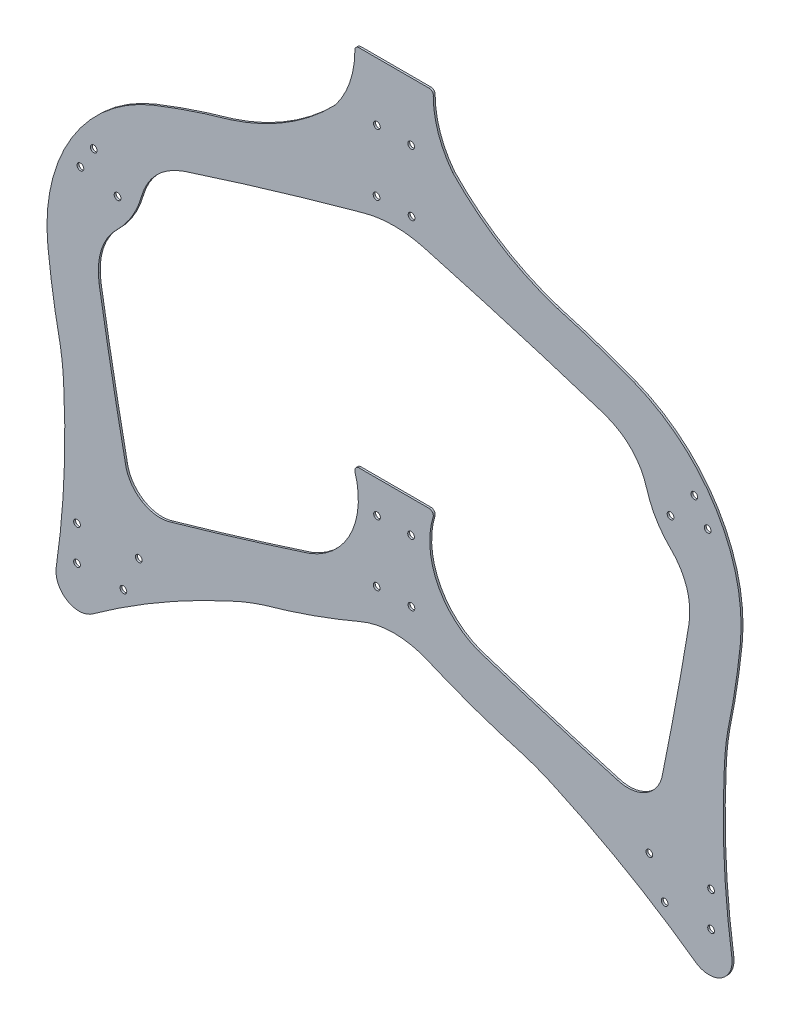
from build123d import *

# Parameters (mm, degrees)
MODEL_R             = 11.1125
BOSS_EXTRUDE1_DEPTH = 6.35


with BuildPart() as part:
    # Model → Boss-Extrude1 (new body)
    with BuildSketch(Plane.XY):
        with BuildLine():
            Line((0, 1378.747657242), (-115.577769156, 1378.747657242))
            ThreePointArc((-115.577769156, 1378.747657242), (-126.354237016, 1373.686301835), (-129.340509975, 1362.161036029))
            ThreePointArc((-129.340509975, 1362.161036029), (-146.260418002, 1263.666616997), (-193.874021232, 1175.800931685))
            ThreePointArc((-193.874021232, 1175.800931685), (-220.418203668, 1149.393572736), (-248.132597313, 1124.217103311))
            ThreePointArc((-248.132597313, 1124.217103311), (-385.537532949, 1027.598742212), (-539.656545931, 960.796392886))
            ThreePointArc((-539.656545931, 960.796392886), (-666.621490092, 921.783047123), (-791.407826106, 876.280206141))
            ThreePointArc((-791.407826106, 876.280206141), (-1063.983941582, 646.703245394), (-1142.358434641, 299.052906014))
            ThreePointArc((-1142.358434641, 299.052906014), (-1125.326882546, 167.325671067), (-1101.531285955, 36.65085415))
            ThreePointArc((-1101.531285955, 36.65085415), (-1096.501853159, 3.57345863), (-1092.816970275, -29.680577618))
            ThreePointArc((-1092.816970275, -29.680577618), (-1090.951890328, -54.49551316), (-1089.83566214, -79.355392158))
            ThreePointArc((-1089.83566214, -79.355392158), (-1089.396534052, -343.386369753), (-1114.815066971, -606.191331934))
            ThreePointArc((-1114.815066971, -606.191331934), (-1079.006418537, -682.346700796), (-994.915452979, -679.089551631))
            ThreePointArc((-994.915452979, -679.089551631), (-773.294078723, -535.574709695), (-538.684025262, -414.452184132))
            ThreePointArc((-538.684025262, -414.452184133), (-516.099583467, -404.002152581), (-493.210405664, -394.237639785))
            ThreePointArc((-493.210405664, -394.237639785), (-461.991455066, -382.204917214), (-430.310537922, -371.447186142))
            ThreePointArc((-430.310537922, -371.447186142), (-268.597105794, -320.492031035), (-110.58408698, -259.014003675))
            ThreePointArc((-110.58408698, -259.014003675), (-56.439186179, -242.1159729), (0, -236.473988301))
            ThreePointArc((0, -236.473988301), (56.43918618, -242.1159729), (110.58408698, -259.014003675))
            ThreePointArc((110.58408698, -259.014003675), (268.597105792, -320.492031034), (430.310537918, -371.447186141))
            ThreePointArc((430.310537918, -371.447186141), (461.991455064, -382.204917213), (493.210405664, -394.237639786))
            ThreePointArc((493.210405664, -394.237639786), (516.099583466, -404.00215258), (538.68402526, -414.452184132))
            ThreePointArc((538.68402526, -414.452184132), (773.294078724, -535.574709696), (994.915452984, -679.089551635))
            ThreePointArc((994.915452984, -679.089551635), (1079.00641854, -682.346700795), (1114.815066971, -606.191331934))
            ThreePointArc((1114.815066971, -606.191331934), (1089.396534052, -343.386369752), (1089.83566214, -79.355392158))
            ThreePointArc((1089.83566214, -79.355392158), (1090.951890328, -54.49551316), (1092.816970275, -29.680577618))
            ThreePointArc((1092.816970275, -29.680577618), (1096.501853159, 3.57345863), (1101.531285955, 36.65085415))
            ThreePointArc((1101.531285955, 36.65085415), (1125.326882546, 167.325671068), (1142.358434641, 299.052906016))
            ThreePointArc((1142.358434641, 299.052906016), (1063.983941581, 646.703245395), (791.407826106, 876.280206141))
            ThreePointArc((791.407826106, 876.280206141), (666.621490092, 921.783047123), (539.656545931, 960.796392886))
            ThreePointArc((539.656545931, 960.796392886), (385.537532949, 1027.598742212), (248.132597313, 1124.217103311))
            ThreePointArc((248.132597313, 1124.217103311), (220.418203668, 1149.393572736), (193.874021232, 1175.800931685))
            ThreePointArc((193.874021232, 1175.800931685), (146.260418002, 1263.666616998), (129.340509975, 1362.161036029))
            ThreePointArc((129.340509975, 1362.161036029), (126.354237016, 1373.686301835), (115.577769156, 1378.747657242))
            Line((115.577769156, 1378.747657242), (0, 1378.747657242))
        make_face()
        with Locations((-1046.167083964, -560.153855558)):
            Circle(MODEL_R, mode=Mode.SUBTRACT)
        with Locations((-1046.167083964, -445.853855558)):
            Circle(MODEL_R, mode=Mode.SUBTRACT)
        with Locations((-893.117492798, -558.918230591)):
            Circle(MODEL_R, mode=Mode.SUBTRACT)
        with Locations((-842.317492798, -444.618230591)):
            Circle(MODEL_R, mode=Mode.SUBTRACT)
        with Locations((-57.451404862, -132.047353673)):
            Circle(MODEL_R, mode=Mode.SUBTRACT)
        with Locations((-56.215779894, 71.187101166)):
            Circle(MODEL_R, mode=Mode.SUBTRACT)
        with BuildLine():
            Line((-831.914958661, -276.08435652), (-832.041240206, -276.007578126))
            ThreePointArc((-832.041240206, -276.007578126), (-868.388484856, -241.139134025), (-886.576073785, -194.169546028))
            ThreePointArc((-886.576073785, -194.169546028), (-931.96319087, 39.874447812), (-973.090543462, 274.704433799))
            ThreePointArc((-973.090543462, 274.704433799), (-974.544978645, 289.261052289), (-975.513775637, 303.85803677))
            ThreePointArc((-975.513775637, 303.85803677), (-961.568129404, 388.552365855), (-913.897564598, 459.932528919))
            ThreePointArc((-913.897564598, 459.932528919), (-864.708312264, 522.01822335), (-833.367311336, 594.764066249))
            ThreePointArc((-833.367311336, 594.764066249), (-793.126920462, 670.574883137), (-725.17703841, 723.009438004))
            ThreePointArc((-725.17703841, 723.009438004), (-708.680158975, 730.452237286), (-691.890632454, 737.209018431))
            ThreePointArc((-691.890632454, 737.209018431), (-396.292230767, 829.345390272), (-98.602105581, 914.481254998))
            ThreePointArc((-98.602105581, 914.481254998), (-49.742837355, 924.383096854), (0, 927.688349599))
            ThreePointArc((0, 927.688349599), (49.742837355, 924.383096854), (98.602105581, 914.481254998))
            ThreePointArc((98.602105581, 914.481254998), (396.292230767, 829.345390272), (691.890632454, 737.209018431))
            ThreePointArc((691.890632454, 737.209018431), (708.680158975, 730.452237286), (725.17703841, 723.009438004))
            ThreePointArc((725.17703841, 723.009438004), (793.126920462, 670.574883137), (833.367311336, 594.764066249))
            ThreePointArc((833.367311336, 594.764066249), (864.708312263, 522.01822335), (913.897564598, 459.932528919))
            ThreePointArc((913.897564598, 459.932528919), (961.568129404, 388.552365855), (975.513775637, 303.85803677))
            ThreePointArc((975.513775637, 303.85803677), (974.544978645, 289.261052289), (973.090543462, 274.704433799))
            ThreePointArc((973.090543462, 274.704433799), (931.96319087, 39.874447812), (886.576073785, -194.169546028))
            ThreePointArc((886.576073785, -194.169546028), (868.388484856, -241.139134025), (832.041240206, -276.007578126))
            Line((832.041240206, -276.007578126), (831.914958661, -276.08435652))
            ThreePointArc((831.914958661, -276.08435652), (807.369425083, -287.337866314), (780.889836792, -292.625219642))
            ThreePointArc((780.889836792, -292.625219642), (757.229172716, -292.121764326), (734.160728686, -286.837127934))
            ThreePointArc((734.160728686, -286.837127934), (505.487279004, -219.420254227), (278.076451396, -147.859811686))
            ThreePointArc((278.076451396, -147.859811686), (142.535649994, -22.664723546), (129.340509975, 161.376052422))
            ThreePointArc((129.340509975, 161.376052422), (126.354237016, 172.901318228), (115.577769156, 177.962673635))
            Line((115.577769156, 177.962673635), (0, 177.962673635))
            Line((0, 177.962673635), (-115.577769156, 177.962673635))
            ThreePointArc((-115.577769156, 177.962673635), (-126.354237016, 172.901318228), (-129.340509975, 161.376052422))
            ThreePointArc((-129.340509975, 161.376052422), (-142.535649994, -22.664723546), (-278.076451396, -147.859811686))
            ThreePointArc((-278.076451396, -147.859811686), (-505.487279003, -219.420254227), (-734.160728686, -286.837127934))
            ThreePointArc((-734.160728686, -286.837127934), (-757.229172716, -292.121764326), (-780.889836793, -292.625219642))
            ThreePointArc((-780.889836793, -292.625219642), (-807.369425084, -287.337866314), (-831.914958661, -276.08435652))
        make_face(mode=Mode.SUBTRACT)
        with Locations((842.317492798, -444.618230591)):
            Circle(MODEL_R, mode=Mode.SUBTRACT)
        with Locations((893.117492798, -558.918230591)):
            Circle(MODEL_R, mode=Mode.SUBTRACT)
        with Locations((1046.167083964, -560.153855558)):
            Circle(MODEL_R, mode=Mode.SUBTRACT)
        with Locations((1046.167083964, -445.853855558)):
            Circle(MODEL_R, mode=Mode.SUBTRACT)
        with Locations((57.451404862, -132.047353673)):
            Circle(MODEL_R, mode=Mode.SUBTRACT)
        with Locations((56.215779894, 71.187101166)):
            Circle(MODEL_R, mode=Mode.SUBTRACT)
        with Locations((-1034.963380784, 578.321554013)):
            Circle(MODEL_R, mode=Mode.SUBTRACT)
        with Locations((-912.39295322, 555.218585095)):
            Circle(MODEL_R, mode=Mode.SUBTRACT)
        with Locations((-991.017480219, 652.045444179)):
            Circle(MODEL_R, mode=Mode.SUBTRACT)
        with Locations((-57.767812369, 983.012939426)):
            Circle(MODEL_R, mode=Mode.SUBTRACT)
        with Locations((-56.532187402, 1186.247394265)):
            Circle(MODEL_R, mode=Mode.SUBTRACT)
        with Locations((912.39295322, 555.218585095)):
            Circle(MODEL_R, mode=Mode.SUBTRACT)
        with Locations((1034.963380784, 578.321554013)):
            Circle(MODEL_R, mode=Mode.SUBTRACT)
        with Locations((991.017480219, 652.045444179)):
            Circle(MODEL_R, mode=Mode.SUBTRACT)
        with Locations((57.767812369, 983.012939426)):
            Circle(MODEL_R, mode=Mode.SUBTRACT)
        with Locations((56.532187402, 1186.247394265)):
            Circle(MODEL_R, mode=Mode.SUBTRACT)
    extrude(amount=BOSS_EXTRUDE1_DEPTH)


solid = part.part
